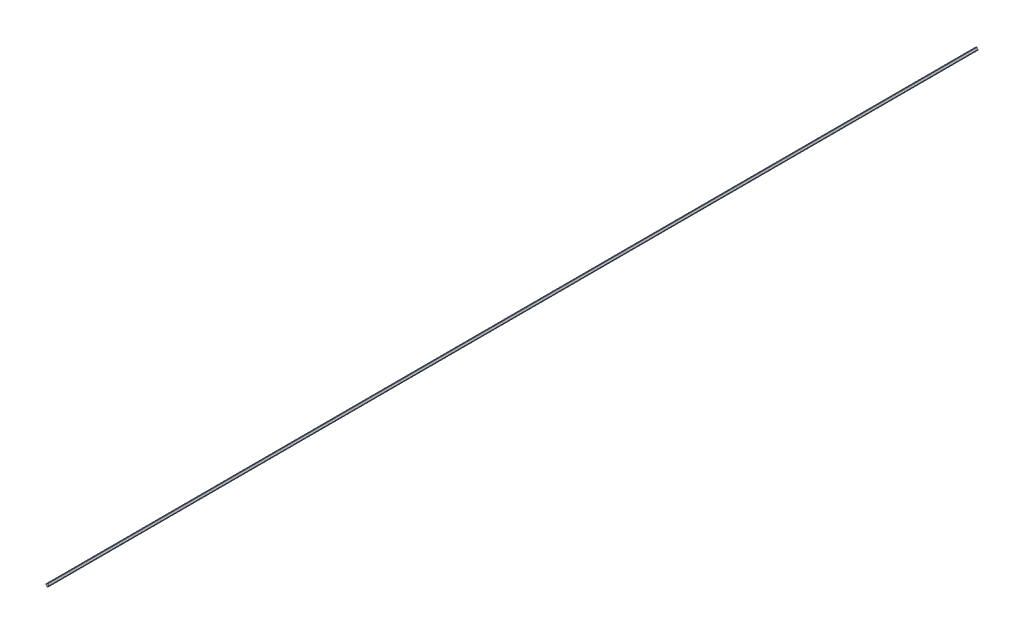
from build123d import *

# Parameters (mm, degrees)
BOSS_EXTRUDE1_DEPTH = 2089.35


with BuildPart() as part:
    # Sketch1 → Boss-Extrude1 (new, symmetric)
    with BuildSketch(Plane.XY):
        with BuildLine():
            Line((1.545, 7.135), (-1.545, 7.135))
            ThreePointArc((-1.545, 7.135), (-3.182273093, 3.182273093), (-7.135, 1.545))
            Line((-7.135, 1.545), (-7.135, -1.545))
            ThreePointArc((-7.135, -1.545), (-3.182273093, -3.182273093), (-1.545, -7.135))
            Line((-1.545, -7.135), (1.545, -7.135))
            ThreePointArc((1.545, -7.135), (3.182273093, -3.182273093), (7.135, -1.545))
            Line((7.135, -1.545), (7.135, 1.545))
            ThreePointArc((7.135, 1.545), (3.182273093, 3.182273093), (1.545, 7.135))
        make_face()
    extrude(amount=BOSS_EXTRUDE1_DEPTH, both=True)


solid = part.part
